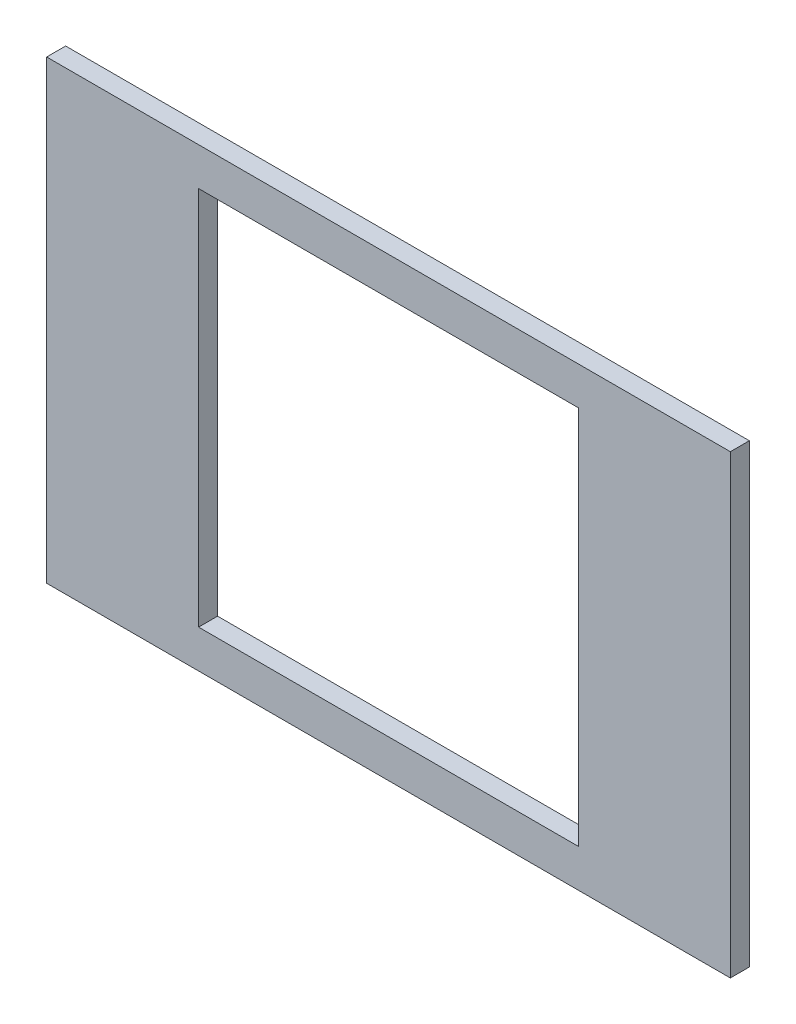
from build123d import *

# Parameters (mm, degrees)
SKETCH1_W           = 457.2
SKETCH1_H           = 304.8
BOSS_EXTRUDE1_DEPTH = 12.7
SKETCH2_W           = 254
SKETCH2_H           = 254
CUT_EXTRUDE1_DEPTH  = 12.7


with BuildPart() as part:
    # Sketch1 → Boss-Extrude1 (new body)
    with BuildSketch(Plane.XY):
        Rectangle(SKETCH1_W, SKETCH1_H)
    extrude(amount=BOSS_EXTRUDE1_DEPTH)

    # Sketch2 → Cut-Extrude1 (cut)
    with BuildSketch(Plane.XY.offset(12.7)):
        Rectangle(SKETCH2_W, SKETCH2_H)
    extrude(amount=-CUT_EXTRUDE1_DEPTH, mode=Mode.SUBTRACT)


solid = part.part
